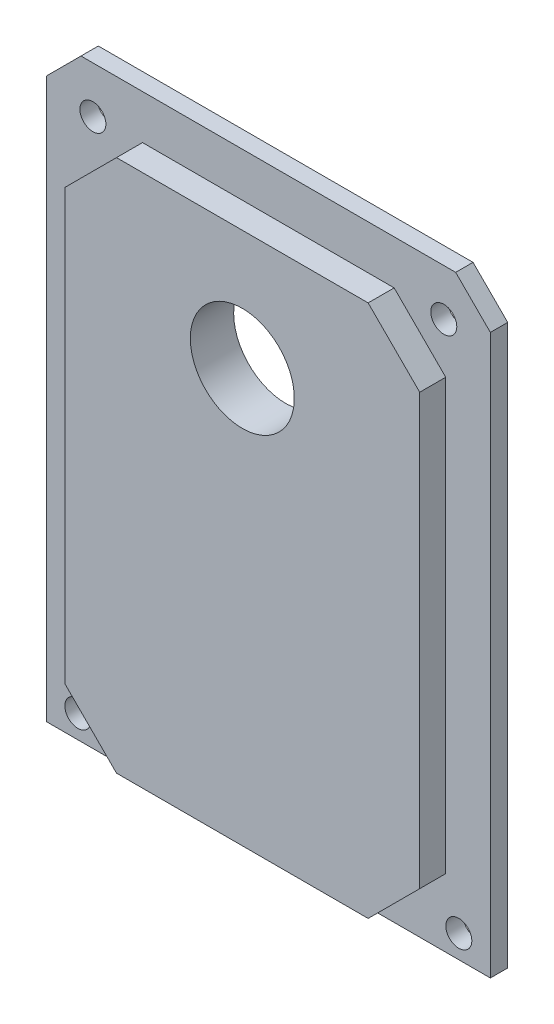
from build123d import *

# Parameters (mm, degrees)
SKETCH1_W           = 51.23
SKETCH1_H           = 68.5
BOSS_EXTRUDE1_DEPTH = 2
CHAMFER1_SIZE       = 4
SKETCH3_W           = 40.93
SKETCH3_H           = 61.5
BOSS_EXTRUDE3_DEPTH = 3
CHAMFER2_SIZE       = 5.95
SKETCH4_R           = 1.5
CUT_EXTRUDE1_DEPTH  = 43.874126522
SKETCH5_R           = 6
CUT_EXTRUDE2_DEPTH  = 44.060314966


with BuildPart() as part:
    # Sketch1 → Boss-Extrude1 (new body)
    with BuildSketch(Plane.XY):
        Rectangle(SKETCH1_W, SKETCH1_H)
    extrude(amount=BOSS_EXTRUDE1_DEPTH)

    # Chamfer1
    chamfer1_edges = [part.edges().sort_by_distance(p)[0] for p in [
        (-25.615, 34.25, 1),
        (25.615, 34.25, 1),
    ]]
    chamfer(chamfer1_edges, length=CHAMFER1_SIZE)

    # Sketch3 → Boss-Extrude3 (add)
    with BuildSketch(Plane.XY.offset(2)):
        with Locations((0, -1.6)):
            Rectangle(SKETCH3_W, SKETCH3_H)
    extrude(amount=BOSS_EXTRUDE3_DEPTH)

    # Chamfer2
    chamfer2_edges = [part.edges().sort_by_distance(p)[0] for p in [
        (20.465, -32.35, 3.5),
        (20.465, 29.15, 3.5),
        (-20.465, 29.15, 3.5),
        (-20.465, -32.35, 3.5),
    ]]
    chamfer(chamfer2_edges, length=CHAMFER2_SIZE)

    # Sketch4 → Cut-Extrude1 (cut, through all)
    with BuildSketch(Plane.XY.offset(2)):
        with Locations((-20.242100654, 28.877100654)):
            Circle(SKETCH4_R)
        with Locations((20.242100654, 28.877100654)):
            Circle(SKETCH4_R)
        with Locations((21.974423525, -31.604966365)):
            Circle(SKETCH4_R)
        with Locations((-21.974423525, -31.604966365)):
            Circle(SKETCH4_R)
    extrude(amount=-CUT_EXTRUDE1_DEPTH, mode=Mode.SUBTRACT)

    # Sketch5 → Cut-Extrude2 (cut, through all)
    with BuildSketch(Plane(origin=(0, 0, 0), x_dir=(-1, 0, 0), z_dir=(0, 0, -1))):
        with Locations((0, 15.35)):
            Circle(SKETCH5_R)
    extrude(amount=-CUT_EXTRUDE2_DEPTH, mode=Mode.SUBTRACT)


solid = part.part
